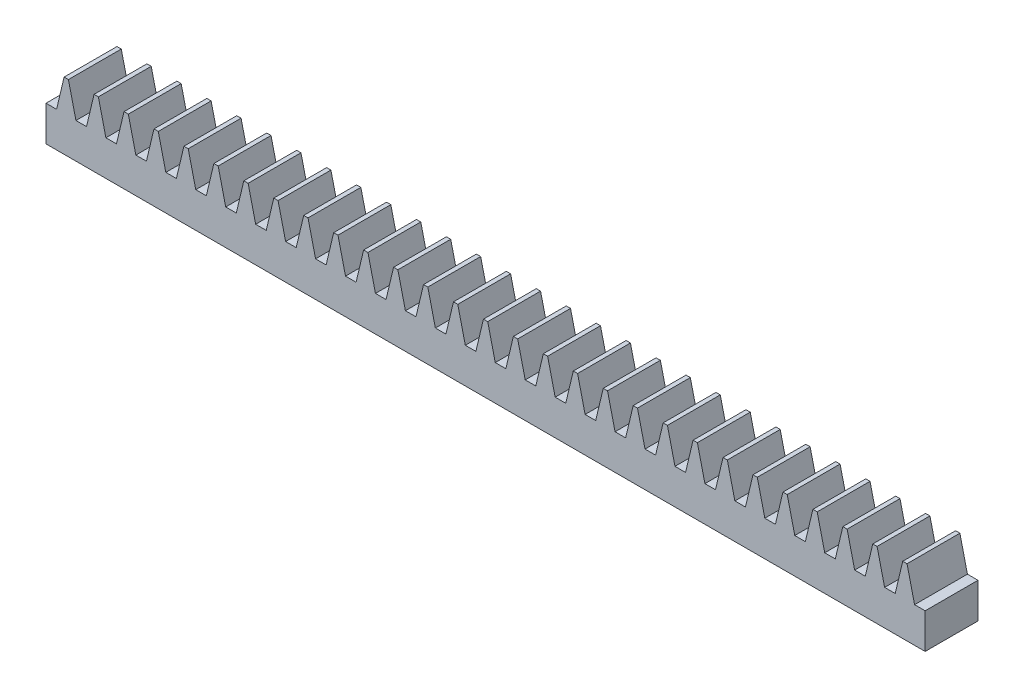
from build123d import *

# Parameters (mm, degrees)
BOSS_EXTRUDE1_DEPTH = 1.5


with BuildPart() as part:
    # Sketch1 → Boss-Extrude1 (new body)
    with BuildSketch(Plane.XY):
        Polygon((0, 0), (0.3, 0), (0.513946728, 0.9), (0.636053272, 0.9), (0.85, 0), (1.15, 0), (1.363946728, 0.9), (1.486053272, 0.9), (1.7, 0), (2, 0), (2.213946728, 0.9), (2.336053272, 0.9), (2.55, 0), (2.85, 0), (3.063946728, 0.9), (3.186053272, 0.9), (3.4, 0), (3.7, 0), (3.913946728, 0.9), (4.036053272, 0.9), (4.25, 0), (4.55, 0), (4.763946728, 0.9), (4.886053272, 0.9), (5.1, 0), (5.4, 0), (5.613946728, 0.9), (5.736053272, 0.9), (5.95, 0), (6.25, 0), (6.463946728, 0.9), (6.586053272, 0.9), (6.8, 0), (7.1, 0), (7.313946728, 0.9), (7.436053272, 0.9), (7.65, 0), (7.95, 0), (8.163946728, 0.9), (8.286053272, 0.9), (8.5, 0), (8.8, 0), (9.013946728, 0.9), (9.136053272, 0.9), (9.35, 0), (9.65, 0), (9.863946728, 0.9), (9.986053272, 0.9), (10.2, 0), (10.5, 0), (10.713946728, 0.9), (10.836053272, 0.9), (11.05, 0), (11.35, 0), (11.563946728, 0.9), (11.686053272, 0.9), (11.9, 0), (12.2, 0), (12.413946728, 0.9), (12.536053272, 0.9), (12.75, 0), (13.05, 0), (13.263946728, 0.9), (13.386053272, 0.9), (13.6, 0), (13.9, 0), (14.113946728, 0.9), (14.236053272, 0.9), (14.45, 0), (14.75, 0), (14.963946728, 0.9), (15.086053272, 0.9), (15.3, 0), (15.6, 0), (15.813946728, 0.9), (15.936053272, 0.9), (16.15, 0), (16.45, 0), (16.663946728, 0.9), (16.786053272, 0.9), (17, 0), (17.3, 0), (17.513946728, 0.9), (17.636053272, 0.9), (17.85, 0), (18.15, 0), (18.363946728, 0.9), (18.486053272, 0.9), (18.7, 0), (19, 0), (19.213946728, 0.9), (19.336053272, 0.9), (19.55, 0), (19.85, 0), (20.063946728, 0.9), (20.186053272, 0.9), (20.4, 0), (20.7, 0), (20.913946728, 0.9), (21.036053272, 0.9), (21.25, 0), (21.55, 0), (21.763946728, 0.9), (21.886053272, 0.9), (22.1, 0), (22.4, 0), (22.613946728, 0.9), (22.736053272, 0.9), (22.95, 0), (23.25, 0), (23.463946728, 0.9), (23.586053272, 0.9), (23.8, 0), (24.1, 0), (24.313946728, 0.9), (24.436053272, 0.9), (24.65, 0), (24.95, 0), (24.95, -1), (0, -1), align=None)
    extrude(amount=BOSS_EXTRUDE1_DEPTH)


solid = part.part
